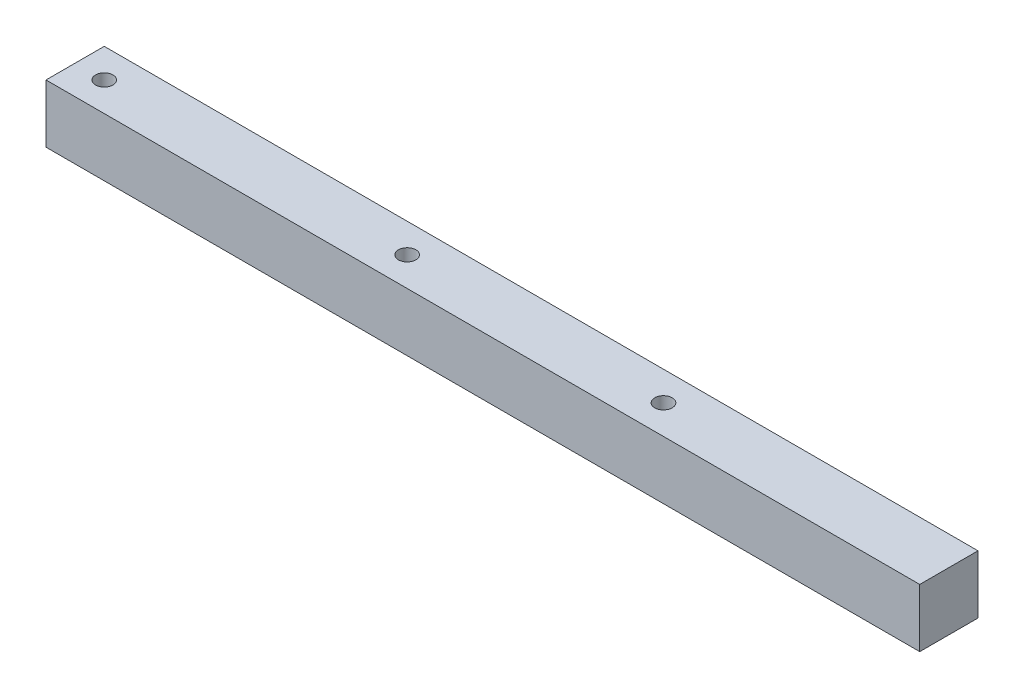
from build123d import *

# Parameters (mm, degrees)
SKIZZE1_W                       = 20
SKIZZE1_H                       = 20
AUFSATZ_LINEAR_AUSTRAGEN1_DEPTH = 300
SKIZZE2_R                       = 3
SCHNITT_LINEAR_AUSTRAGEN1_DEPTH = 301.83217913


with BuildPart() as part:
    # Skizze1 → Aufsatz-Linear austragen1 (new body)
    with BuildSketch(Plane(origin=(0, 0, 0), x_dir=(0, 0, -1), z_dir=(1, 0, 0))):
        Rectangle(SKIZZE1_W, SKIZZE1_H)
    extrude(amount=AUFSATZ_LINEAR_AUSTRAGEN1_DEPTH)

    # Skizze2 → Schnitt-Linear austragen1 (cut, through all)
    with BuildSketch(Plane(origin=(0, 10, 0), x_dir=(1, 0, 0), z_dir=(0, 1, 0))):
        with Locations(Location((10, 0, 0), (0, 0, 270))):
            Circle(SKIZZE2_R)
        with Locations(Location((114, 0, 0), (0, 0, 270))):
            Circle(SKIZZE2_R)
        with Locations(Location((202, 0, 0), (0, 0, 270))):
            Circle(SKIZZE2_R)
    extrude(amount=-SCHNITT_LINEAR_AUSTRAGEN1_DEPTH, mode=Mode.SUBTRACT)


solid = part.part
